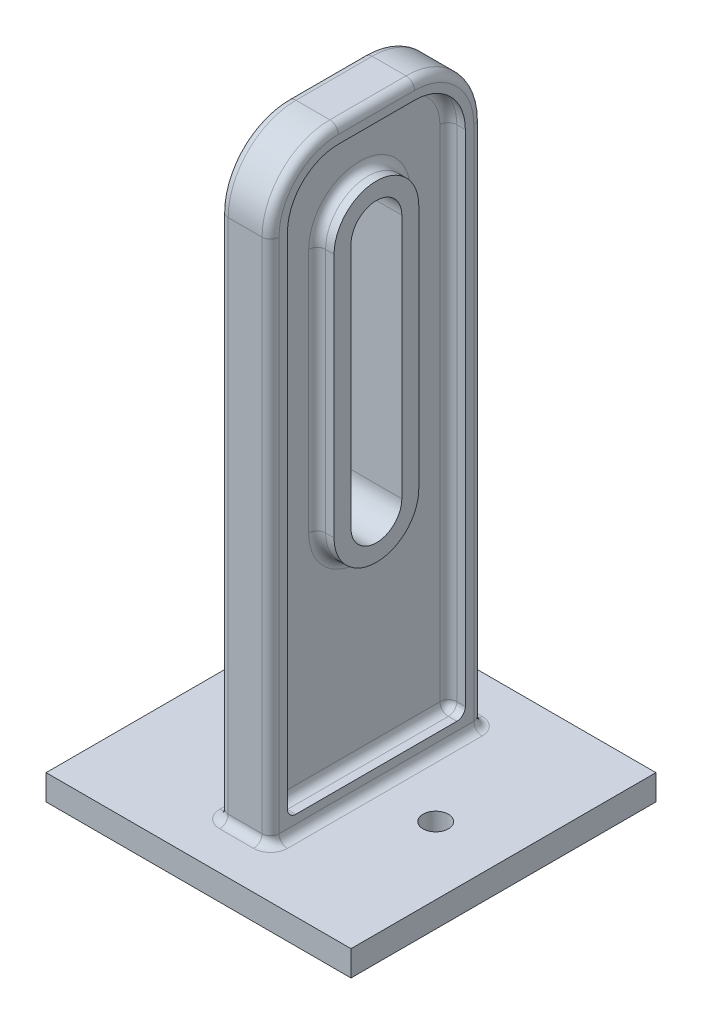
from build123d import *

# Parameters (mm, degrees)
SKETCH1_W           = 36
SKETCH1_H           = 36
BOSS_EXTRUDE1_DEPTH = 3
SKETCH2_R           = 1.5
CUT_EXTRUDE1_DEPTH  = 3
SKETCH3_W           = 6
SKETCH3_H           = 25
BOSS_EXTRUDE2_DEPTH = 70
CUT_EXTRUDE2_DEPTH  = 70
FILLET1_R           = 8
CUT_EXTRUDE3_DEPTH  = 2
BOSS_EXTRUDE3_START = 2
BOSS_EXTRUDE3_DEPTH = 2
FILLET2_R           = 1


with BuildPart() as part:
    # Sketch1 → Boss-Extrude1 (new body)
    with BuildSketch(Plane(origin=(0, 0, 0), x_dir=(1, 0, 0), z_dir=(0, 1, 0))):
        Rectangle(SKETCH1_W, SKETCH1_H)
    extrude(amount=BOSS_EXTRUDE1_DEPTH)

    # Sketch2 → Cut-Extrude1 (cut)
    with BuildSketch(Plane(origin=(0, 3, 0), x_dir=(1, 0, 0), z_dir=(0, 1, 0))):
        with Locations(Location((-10, 0, 0), (0, 0, 270))):
            Circle(SKETCH2_R)
        with Locations(Location((10, 0, 0), (0, 0, 90))):
            Circle(SKETCH2_R)
    extrude(amount=-CUT_EXTRUDE1_DEPTH, mode=Mode.SUBTRACT)

    # Sketch3 → Boss-Extrude2 (add)
    with BuildSketch(Plane(origin=(0, 3, 0), x_dir=(1, 0, 0), z_dir=(0, 1, 0))):
        Rectangle(SKETCH3_W, SKETCH3_H)
    extrude(amount=BOSS_EXTRUDE2_DEPTH)

    # Sketch4 → Cut-Extrude2 (cut)
    with BuildSketch(Plane(origin=(3, 0, 0), x_dir=(0, 0, -1), z_dir=(1, 0, 0))):
        with BuildLine():
            Line((-3, 60), (-3, 31))
            ThreePointArc((-3, 31), (0, 28), (3, 31))
            Line((3, 31), (3, 60))
            ThreePointArc((3, 60), (0, 63), (-3, 60))
        make_face()
    extrude(amount=-CUT_EXTRUDE2_DEPTH, mode=Mode.SUBTRACT)

    # Fillet1
    fillet1_edges = [part.edges().sort_by_distance(p)[0] for p in [
        (0, 73, -12.5),
        (0, 73, 12.5),
    ]]
    fillet(fillet1_edges, radius=FILLET1_R)

    # Sketch5 → Cut-Extrude3 (cut)
    with BuildSketch(Plane(origin=(3, 0, 0), x_dir=(0, 0, -1), z_dir=(1, 0, 0))):
        with BuildLine():
            Line((4.5, 71), (-4.5, 71))
            ThreePointArc((-4.5, 71), (-8.742640687, 69.242640687), (-10.5, 65))
            Line((-10.5, 65), (-10.5, 5))
            Line((-10.5, 5), (10.5, 5))
            Line((10.5, 5), (10.5, 65))
            ThreePointArc((10.5, 65), (8.742640687, 69.242640687), (4.5, 71))
        make_face()
    cut_extrude3 = extrude(amount=-CUT_EXTRUDE3_DEPTH, mode=Mode.SUBTRACT)

    # Sketch6 → Boss-Extrude3 (add)
    with BuildSketch(Plane(origin=(1, 0, 0), x_dir=(0, 0, -1), z_dir=(1, 0, 0)).offset(BOSS_EXTRUDE3_START)):
        with BuildLine():
            Line((-5, 60), (-5, 31))
            ThreePointArc((-5, 31), (0, 26), (5, 31))
            Line((5, 31), (5, 60))
            ThreePointArc((5, 60), (0, 65), (-5, 60))
        make_face()
        with BuildLine():
            Line((3, 31), (3, 60))
            ThreePointArc((3, 60), (0, 63), (-3, 60))
            Line((-3, 60), (-3, 31))
            ThreePointArc((-3, 31), (0, 28), (3, 31))
        make_face(mode=Mode.SUBTRACT)
    boss_extrude3 = extrude(amount=-BOSS_EXTRUDE3_DEPTH)

    # Mirror1: Cut-Extrude3, Boss-Extrude3 across plane
    add(cut_extrude3.mirror(Plane(origin=(0, 0, 0), x_dir=(0, 0, 1), z_dir=(1, 0, 0))), mode=Mode.SUBTRACT)
    add(boss_extrude3.mirror(Plane(origin=(0, 0, 0), x_dir=(0, 0, 1), z_dir=(1, 0, 0))))

    # Fillet2
    fillet2_edges = [part.edges().sort_by_distance(p)[0] for p in [
        (-1, 69.242640687, -8.742640687),
        (-1, 71, 0),
        (-1, 69.242640687, 8.742640687),
        (-1, 35, 10.5),
        (-1, 5, 0),
        (-1, 35, -10.5),
        (-2, 5, 10.5),
        (-2, 5, -10.5),
        (-1, 26, 0),
        (-1, 45.5, -5),
        (-1, 65, 0),
        (-1, 45.5, 5),
        (3, 3, 0),
        (0, 3, -12.5),
        (-3, 3, 0),
        (0, 3, 12.5),
        (3, 73, 0),
        (-3, 73, 0),
        (3, 34, -12.5),
        (3, 34, 12.5),
        (3, 70.656854249, -10.156854249),
        (3, 70.656854249, 10.156854249),
        (-3, 34, 12.5),
        (-3, 34, -12.5),
        (-3, 70.656854249, -10.156854249),
        (-3, 70.656854249, 10.156854249),
        (1, 69.242640687, -8.742640687),
        (1, 35, -10.5),
        (1, 5, 0),
        (2, 5, -10.5),
        (1, 35, 10.5),
        (2, 5, 10.5),
        (1, 69.242640687, 8.742640687),
        (1, 71, 0),
        (1, 26, 0),
        (1, 45.5, -5),
        (1, 65, 0),
        (1, 45.5, 5),
    ]]
    fillet(fillet2_edges, radius=FILLET2_R)


solid = part.part
